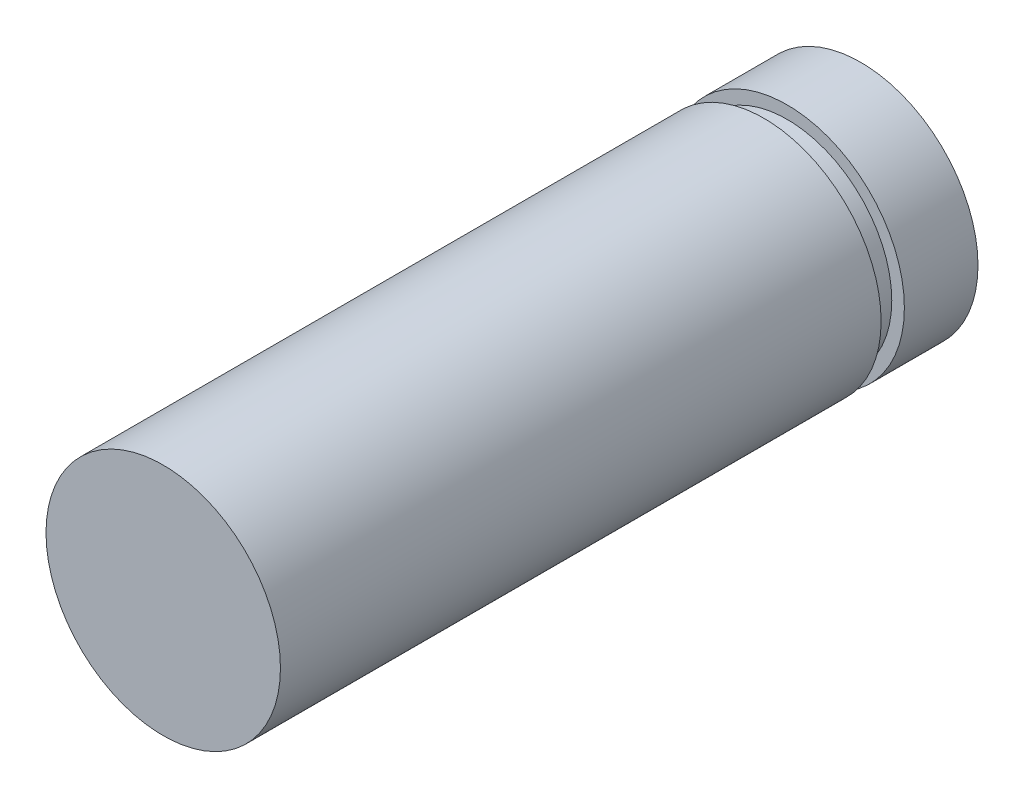
from build123d import *

# Parameters (mm, degrees)
SKETCH1_R           = 3.025
BOSS_EXTRUDE1_DEPTH = 18


with BuildPart() as part:
    # Sketch1 → Boss-Extrude1 (new body)
    with BuildSketch(Plane.XY):
        Circle(SKETCH1_R)
    extrude(amount=BOSS_EXTRUDE1_DEPTH)

    # Sketch3 → Groove for ANSI B27.7 - 3BM1-8, Basic Internal Retaining Ring1 (revolve, cut)
    with BuildSketch(Plane(origin=(0, 0, 18), x_dir=(0, 1, 0), z_dir=(-1, 0, 0)), mode=Mode.PRIVATE) as groove_for_ansi_b27_7_3bm1_8_basic_in_sk:
        with BuildLine():
            Line((4.1, 15.5), (2.7, 15.5))
            Line((2.7, 15.5), (2.7, 16.1))
            Line((2.7, 16.1), (4.1, 16.1))
            ThreePointArc((4.1, 16.1), (4.170710678, 16.070710678), (4.2, 16))
            Line((4.2, 16), (4.2, 15.6))
            ThreePointArc((4.2, 15.6), (4.170710678, 15.529289322), (4.1, 15.5))
        make_face()
    revolve(groove_for_ansi_b27_7_3bm1_8_basic_in_sk.sketch.rotate(Axis((0, 0, 68), (0, 0, -1)), 270), axis=Axis((0, 0, 68), (0, 0, -1)), mode=Mode.SUBTRACT)


solid = part.part
